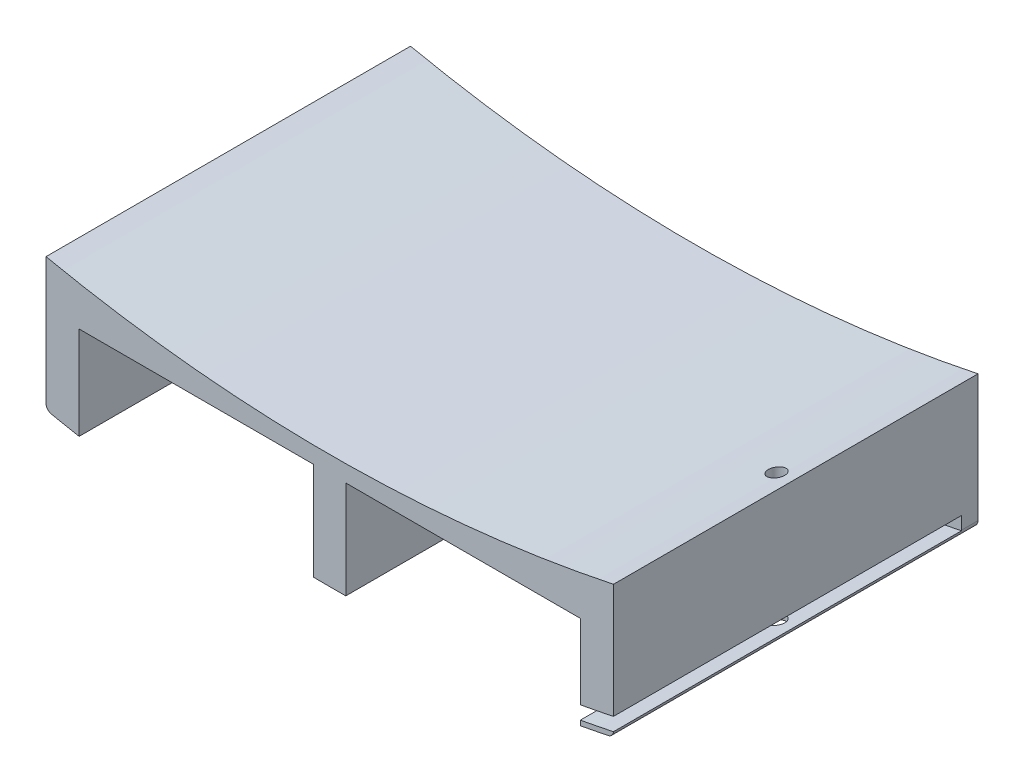
from build123d import *

# Parameters (mm, degrees)
BOSS_EXTRUDE2_DEPTH     = 279.4
CUT_EXTRUDE1_DEPTH      = 279.4
FILLET1_R               = 2.54
SKETCH7_W               = 192.0875
SKETCH7_H               = 254
CUT_EXTRUDE2_DEPTH      = 44.45
SKETCH8_W               = 6.173248721
SKETCH8_H               = 35.639061591
BOSS_EXTRUDE3_DEPTH     = 258.064
CUT_EXTRUDE3_DEPTH      = 260.35
CUT_EXTRUDE3_DEPTH_BACK = 6.35
CUT_EXTRUDE4_DEPTH      = 260.35
CUT_EXTRUDE4_DEPTH_BACK = 6.35
BOSS_EXTRUDE4_DEPTH     = 254
SKETCH18_R              = 3.175
CUT_EXTRUDE5_DEPTH      = 71.12


with BuildPart() as part:
    # CrossSection → Boss-Extrude2 (new body)
    with BuildSketch(Plane.XY):
        with BuildLine():
            Line((108.74375, 11.322324676), (108.74375, -50.8))
            Line((108.74375, -50.8), (-108.74375, -50.8))
            Line((-108.74375, -50.8), (-108.74375, 11.322324676))
            ThreePointArc((-108.74375, 11.322324676), (0, 0), (108.74375, 11.322324676))
        make_face()
    extrude(amount=BOSS_EXTRUDE2_DEPTH)

    # Sketch4 → Cut-Extrude1 (cut)
    with BuildSketch(Plane(origin=(0, 0, 0), x_dir=(-1, 0, 0), z_dir=(0, 0, -1))):
        with BuildLine():
            ThreePointArc((0, -50.8), (-54.665798723, -47.96178867), (-108.74375, -39.477675324))
            Line((-108.74375, -39.477675324), (-108.74375, -50.8))
            Line((-108.74375, -50.8), (0, -50.8))
        make_face()
        with BuildLine():
            ThreePointArc((108.74375, -39.477675324), (54.665798723, -47.96178867), (0, -50.8))
            Line((0, -50.8), (108.74375, -50.8))
            Line((108.74375, -50.8), (108.74375, -39.477675324))
        make_face()
    extrude(amount=-CUT_EXTRUDE1_DEPTH, mode=Mode.SUBTRACT)

    # Fillet1
    fillet1_edges = [part.edges().sort_by_distance(p)[0] for p in [
        (108.74375, -39.477675324, 139.7),
        (-108.74375, -39.477675324, 139.7),
    ]]
    fillet(fillet1_edges, radius=FILLET1_R)

    # Sketch7 → Cut-Extrude2 (cut)
    with BuildSketch(Plane(origin=(0, -50.8, 0), x_dir=(1, 0, 0), z_dir=(0, 1, 0))):
        with Locations((0, -139.7)):
            Rectangle(SKETCH7_W, SKETCH7_H)
    extrude(amount=CUT_EXTRUDE2_DEPTH, mode=Mode.SUBTRACT)

    # Sketch8 → Boss-Extrude3 (add)
    with BuildSketch(Plane.XY.offset(12.7)):
        with Locations((3.086624361, -24.169530796)):
            Rectangle(SKETCH8_W, SKETCH8_H)
        with Locations((-3.086624361, -24.169530796)):
            Rectangle(SKETCH8_W, SKETCH8_H)
    extrude(amount=BOSS_EXTRUDE3_DEPTH)

    # Sketch13 → Cut-Extrude3 (cut, two sides: drawn at the far end of the back side and taken through both)
    with BuildSketch(Plane.XY.offset(12.7).offset(-CUT_EXTRUDE3_DEPTH_BACK)):
        with BuildLine():
            ThreePointArc((-96.04375, -40.123592373), (-48.223527841, -46.727181022), (0, -48.934530782))
            Line((0, -48.934530782), (0, -43.854530782))
            ThreePointArc((0, -43.854530782), (-48.223527841, -41.647181022), (-96.04375, -35.043592373))
            Line((-96.04375, -35.043592373), (-96.04375, -37.583592373))
            Line((-96.04375, -37.583592373), (-96.04375, -40.123592373))
        make_face()
        with BuildLine():
            Line((0, -43.854530782), (0, -48.934530782))
            ThreePointArc((0, -48.934530782), (48.223527841, -46.727181022), (96.04375, -40.123592373))
            Line((96.04375, -40.123592373), (96.04375, -37.583592373))
            Line((96.04375, -37.583592373), (96.04375, -35.043592373))
            ThreePointArc((96.04375, -35.043592373), (48.223527841, -41.647181022), (0, -43.854530782))
        make_face()
    extrude(amount=CUT_EXTRUDE3_DEPTH + CUT_EXTRUDE3_DEPTH_BACK, mode=Mode.SUBTRACT)

    # Sketch14 → Cut-Extrude4 (cut, two sides: drawn at the far end of the back side and taken through both)
    with BuildSketch(Plane(origin=(0, 0, 266.7), x_dir=(-1, 0, 0), z_dir=(0, 0, -1)).offset(-CUT_EXTRUDE4_DEPTH_BACK)):
        with BuildLine():
            Line((96.04375, -35.043592373), (96.04375, -40.123592373))
            ThreePointArc((96.04375, -40.123592373), (-28.026510339, -48.189989717), (-150.541934286, -27.012946445))
            Line((-150.541934286, -27.012946445), (-150.541934286, -21.932946445))
            ThreePointArc((-150.541934286, -21.932946445), (-28.026510339, -43.109989717), (96.04375, -35.043592373))
        make_face()
    extrude(amount=CUT_EXTRUDE4_DEPTH + CUT_EXTRUDE4_DEPTH_BACK, mode=Mode.SUBTRACT)

    # Sketch15 → Boss-Extrude4 (add)
    with BuildSketch(Plane(origin=(0, 0, 266.7), x_dir=(-1, 0, 0), z_dir=(0, 0, -1))):
        with BuildLine():
            Line((6.173248721, -43.818432493), (6.173248721, -41.989061591))
            Line((6.173248721, -41.989061591), (-6.173248721, -41.989061591))
            Line((-6.173248721, -41.989061591), (-6.173248721, -43.818432493))
            ThreePointArc((-6.173248721, -43.818432493), (0, -43.854530782), (6.173248721, -43.818432493))
        make_face()
    extrude(amount=BOSS_EXTRUDE4_DEPTH)

    # Sketch18 → Cut-Extrude5 (cut)
    with BuildSketch(Plane(origin=(0, -50.8, 0), x_dir=(1, 0, 0), z_dir=(0, 1, 0))):
        with Locations(Location((101.380501252, -209.55, 0), (0, 0, 90))):
            Circle(SKETCH18_R)
        with Locations(Location((101.380501252, -69.85, 0), (0, 0, 90))):
            Circle(SKETCH18_R)
    extrude(amount=CUT_EXTRUDE5_DEPTH, mode=Mode.SUBTRACT)


with BuildPart() as body_2:
    # Split2: the piece on the far side of the plane
    add(part.part)
    split(bisect_by=Plane.XY.offset(139.7), keep=Keep.BOTTOM)


with BuildPart() as part_1:
    add(part.part)

    # Split2
    split(bisect_by=Plane.XY.offset(139.7), keep=Keep.TOP)


solid = body_2.part
